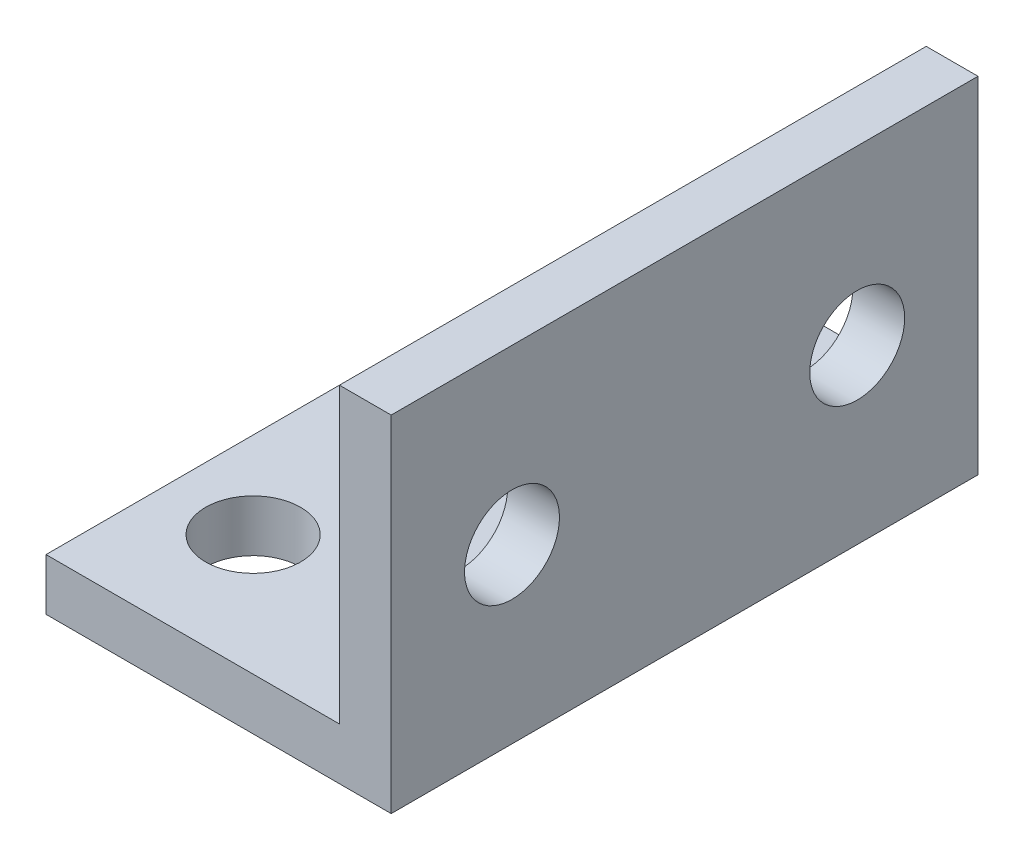
from build123d import *

# Parameters (mm, degrees)
EXTRUDE_1_DEPTH     = 34
SKETCH_2_R          = 2.75
CUT_EXTRUDE_1_DEPTH = 43.95346319
SKETCH_3_R          = 2.75
CUT_EXTRUDE_2_DEPTH = 45.226688775


with BuildPart() as part:
    # ｽｹｯﾁ1 → ﾎﾞｽ - 押し出し1 (new body)
    with BuildSketch(Plane.XY):
        Polygon((0, 0), (17, 0), (17, 17), (20, 17), (20, -3), (0, -3), align=None)
    extrude(amount=EXTRUDE_1_DEPTH)

    # ｽｹｯﾁ2 → ｶｯﾄ - 押し出し1 (cut, through all)
    with BuildSketch(Plane(origin=(20, 0, 0), x_dir=(0, 0, -1), z_dir=(1, 0, 0))):
        with Locations((-27, 7)):
            Circle(SKETCH_2_R)
        with Locations((-7, 7)):
            Circle(SKETCH_2_R)
    extrude(amount=-CUT_EXTRUDE_1_DEPTH, mode=Mode.SUBTRACT)

    # ｽｹｯﾁ3 → ｶｯﾄ - 押し出し2 (cut, through all)
    with BuildSketch(Plane.XZ.offset(3)):
        with Locations(Location((5, 7, 0), (0, 0, 270))):
            Circle(SKETCH_3_R)
        with Locations(Location((5, 27, 0), (0, 0, 270))):
            Circle(SKETCH_3_R)
    extrude(amount=-CUT_EXTRUDE_2_DEPTH, mode=Mode.SUBTRACT)


solid = part.part
